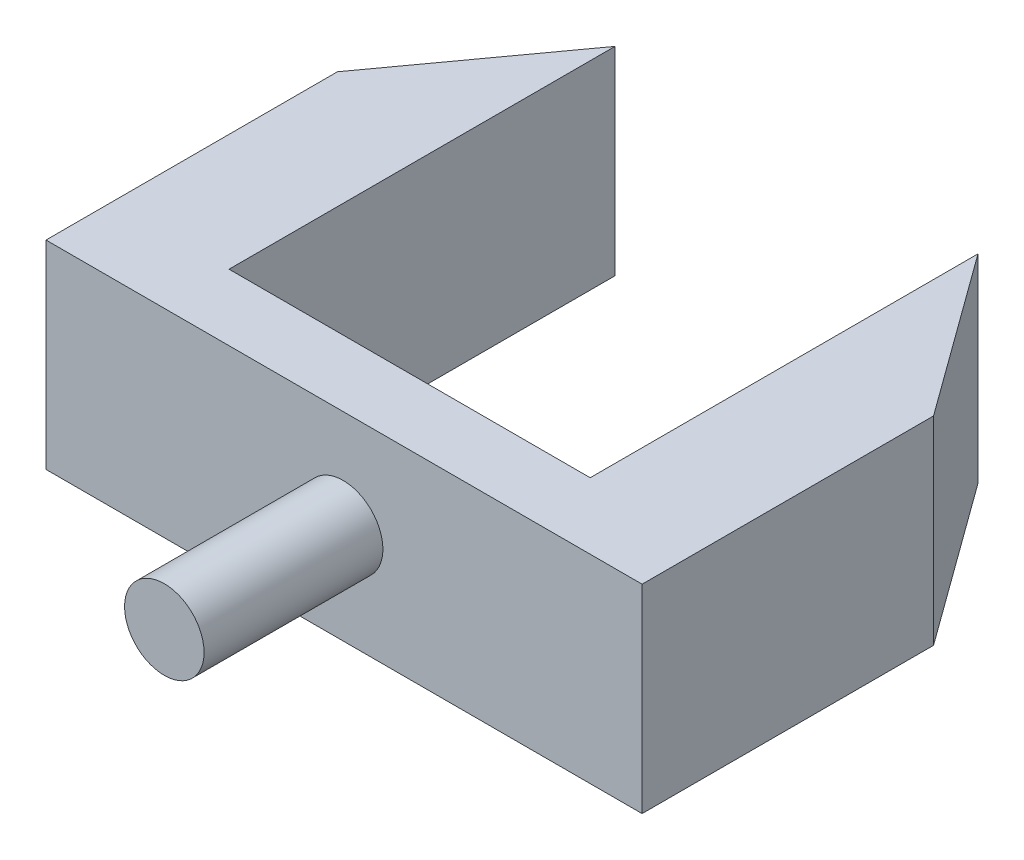
from build123d import *

# Parameters (mm, degrees)
BOSS_EXTRUDE1_DEPTH = 15
SKETCH4_R           = 3
BOSS_EXTRUDE2_DEPTH = 13.5


with BuildPart() as part:
    # Sketch3 → Boss-Extrude1 (new body)
    with BuildSketch(Plane(origin=(0, 0, 0), x_dir=(1, 0, 0), z_dir=(0, 1, 0))):
        Polygon((-22.362385321, 0), (22.637614679, 0), (22.637614679, 22), (13.718917102, 34.275534099), (13.718917102, 5), (-13.545606537, 5), (-13.545606537, 34.135254916), (-22.362385321, 22), align=None)
    extrude(amount=BOSS_EXTRUDE1_DEPTH)

    # Sketch4 → Boss-Extrude2 (add)
    with BuildSketch(Plane.XY):
        with Locations(Location((0.068807339, 7.5, 0), (0, 0, 180))):
            Circle(SKETCH4_R)
    extrude(amount=BOSS_EXTRUDE2_DEPTH)


solid = part.part
